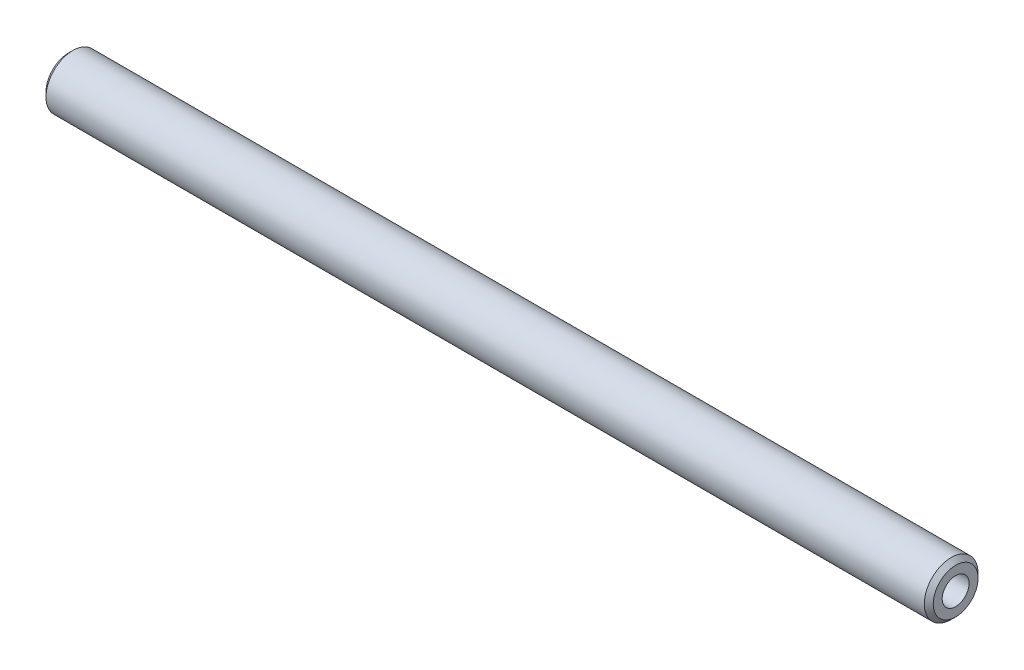
from build123d import *

# Parameters (mm, degrees)
SKETCH_1_W                     = 99
SKETCH_1_H                     = 3
CHAMFER_1_SIZE                 = 0.5
M3X0_5_1_D                     = 2.5
M3X0_5_1_DEPTH                 = 8.5
M3X0_5_1_CBORE_D               = 3
M3X0_5_1_CBORE_DEPTH           = 6
M3X0_5_1_TIP                   = 0.751075774
M3X0_5_1_ON_FACE_2_D           = 2.5
M3X0_5_1_ON_FACE_2_DEPTH       = 8.5
M3X0_5_1_ON_FACE_2_CBORE_D     = 3
M3X0_5_1_ON_FACE_2_CBORE_DEPTH = 6
M3X0_5_1_ON_FACE_2_TIP         = 0.751075774


with BuildPart() as part:
    # ｽｹｯﾁ1 → 回転1 (revolve)
    with BuildSketch(Plane.XY, mode=Mode.PRIVATE) as revolve_1_sk:
        with Locations((0, 1.5)):
            Rectangle(SKETCH_1_W, SKETCH_1_H)
    revolve(revolve_1_sk.sketch.rotate(Axis((0, 0, 0), (1, 0, 0)), 90), axis=Axis((0, 0, 0), (1, 0, 0)))

    # 面取り1
    chamfer_1_edges = [part.edges().sort_by_distance(p)[0] for p in [
        (49.5, 0, -3),
        (-49.5, 0, -3),
    ]]
    chamfer(chamfer_1_edges, length=CHAMFER_1_SIZE)

    # M3x0.5 ねじ穴1
    with Locations(Plane(origin=(49.5, 0, 0), x_dir=(0, 0, 1), z_dir=(1, 0, 0))):
        with Locations((0, 0)):
            CounterBoreHole(M3X0_5_1_D / 2, M3X0_5_1_CBORE_D / 2, M3X0_5_1_CBORE_DEPTH, depth=M3X0_5_1_DEPTH)
            with Locations((0, 0, -(M3X0_5_1_DEPTH + M3X0_5_1_TIP / 2))):  # 118° drill point
                Cone(0, M3X0_5_1_D / 2, M3X0_5_1_TIP, mode=Mode.SUBTRACT)

    # M3x0.5 ねじ穴1 on face 2
    with Locations(Plane(origin=(-49.5, 0, 0), x_dir=(0, 0, -1), z_dir=(-1, 0, 0))):
        with Locations((0, 0)):
            CounterBoreHole(M3X0_5_1_ON_FACE_2_D / 2, M3X0_5_1_ON_FACE_2_CBORE_D / 2, M3X0_5_1_ON_FACE_2_CBORE_DEPTH, depth=M3X0_5_1_ON_FACE_2_DEPTH)
            with Locations((0, 0, -(M3X0_5_1_ON_FACE_2_DEPTH + M3X0_5_1_ON_FACE_2_TIP / 2))):  # 118° drill point
                Cone(0, M3X0_5_1_ON_FACE_2_D / 2, M3X0_5_1_ON_FACE_2_TIP, mode=Mode.SUBTRACT)


solid = part.part
